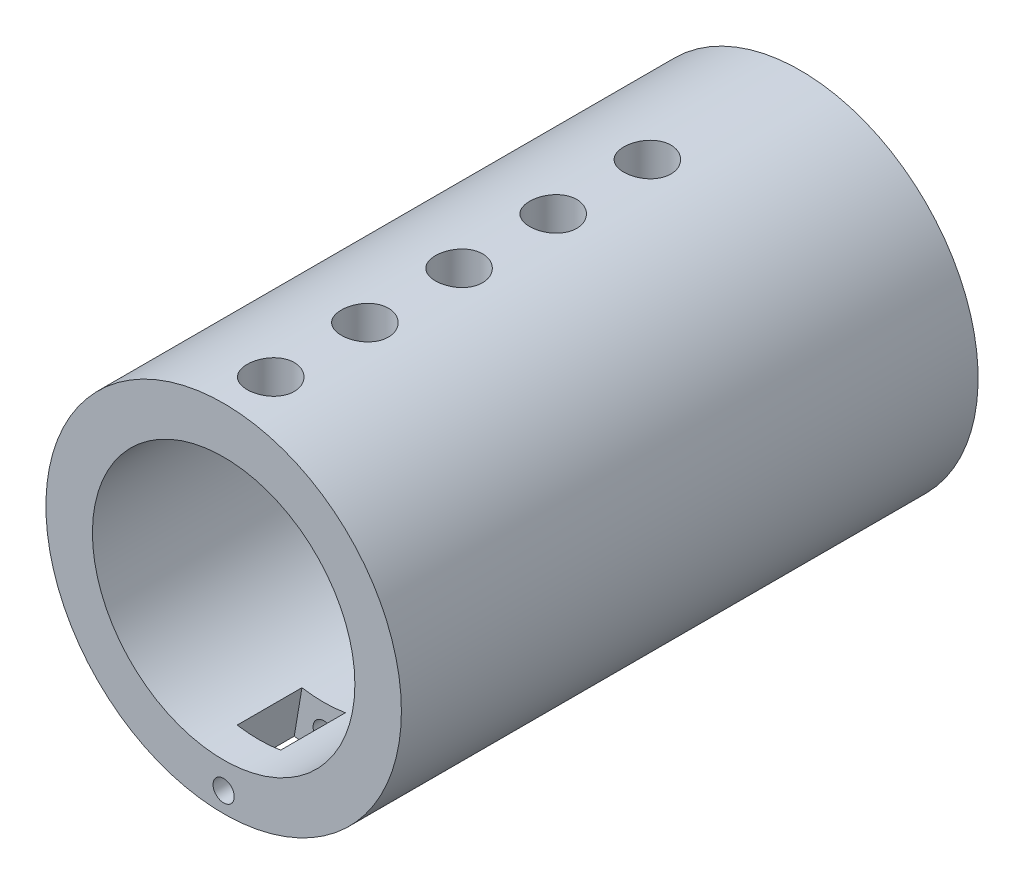
from build123d import *

# Parameters (mm, degrees)
SKETCH1_R           = 15.102178337
SKETCH1_R_2         = 11.15
BOSS_EXTRUDE1_DEPTH = 49
SKETCH2_W           = 2
SKETCH2_H           = 2
CUT_EXTRUDE1_DEPTH  = 2
CUT_EXTRUDE2_DEPTH  = 1.1
SKETCH7_R           = 2
PIN_HOLE_DEPTH      = 54.452329987
CUT_EXTRUDE4_START  = -8.5
CUT_EXTRUDE4_DEPTH  = 5.5
CUT_EXTRUDE5_START  = -15
CUT_EXTRUDE5_DEPTH  = 15


with BuildPart() as part:
    # Sketch1 → Boss-Extrude1 (new body)
    with BuildSketch(Plane.XY):
        Circle(SKETCH1_R)
        Circle(SKETCH1_R_2, mode=Mode.SUBTRACT)
    extrude(amount=BOSS_EXTRUDE1_DEPTH)

    # Sketch2 → Cut-Extrude1 (cut)
    with BuildSketch(Plane(origin=(0, 0, 0), x_dir=(-1, 0, 0), z_dir=(0, 0, -1))):
        with BuildLine():
            Line((2, -14.969161317), (0, -14.969161317))
            Line((0, -14.969161317), (0, -15.102178337))
            ThreePointArc((0, -15.102178337), (1.002209251, -15.068887389), (2, -14.969161317))
        make_face()
        with BuildLine():
            Line((0, -15.102178337), (0, -14.969161317))
            Line((0, -14.969161317), (-2, -14.969161317))
            ThreePointArc((-2, -14.969161317), (-1.002209251, -15.068887389), (0, -15.102178337))
        make_face()
        with Locations((1, -13.969161317)):
            Rectangle(SKETCH2_W, SKETCH2_H)
        with Locations((-1, -13.969161317)):
            Rectangle(SKETCH2_W, SKETCH2_H)
    extrude(amount=-CUT_EXTRUDE1_DEPTH, mode=Mode.SUBTRACT)

    # Sketch6 → Cut-Extrude2 (cut)
    with BuildSketch(Plane(origin=(0, 0, 0), x_dir=(-1, 0, 0), z_dir=(0, 0, -1))):
        with BuildLine():
            Line((-1.931965643, -12.197951006), (-1.744244285, -11.012724998))
            ThreePointArc((-1.744244285, -11.012724998), (-7.241345739, 8.478526516), (11.15, 0))
            ThreePointArc((11.15, 0), (8.478526516, -7.241345739), (1.744244285, -11.012724998))
            Line((1.744244285, -11.012724998), (1.931965643, -12.197951006))
            ThreePointArc((1.931965643, -12.197951006), (9.391013675, -8.020683397), (12.35, 0))
            ThreePointArc((12.35, 0), (-8.020683397, 9.391013675), (-1.931965643, -12.197951006))
        make_face()
    extrude(amount=-CUT_EXTRUDE2_DEPTH, mode=Mode.SUBTRACT)

    # Sketch7 → Pin hole (cut, through all)
    with BuildSketch(Plane(origin=(0, 0, 0), x_dir=(1, 0, 0), z_dir=(0, 1, 0))):
        with Locations(Location((0, -13, 0), (0, 0, 90))):
            Circle(SKETCH7_R)
        with Locations(Location((0, -21, 0), (0, 0, 90))):
            Circle(SKETCH7_R)
        with Locations(Location((0, -29, 0), (0, 0, 90))):
            Circle(SKETCH7_R)
        with Locations(Location((0, -37, 0), (0, 0, 90))):
            Circle(SKETCH7_R)
        with Locations(Location((0, -45, 0), (0, 0, 90))):
            Circle(SKETCH7_R)
    extrude(amount=PIN_HOLE_DEPTH, mode=Mode.SUBTRACT)

    # Sketch8 → Cut-Extrude4 (cut)
    with BuildSketch(Plane.XY.offset(49).offset(CUT_EXTRUDE4_START)):
        with BuildLine():
            Line((2.5, -14.893817192), (1.845760219, -10.996166114))
            ThreePointArc((1.845760219, -10.996166114), (0.926079863, -11.111474974), (0, -11.15))
            Line((0, -11.15), (0, -12.502178337))
            ThreePointArc((0, -12.502178337), (0.636396103, -12.765782234), (0.9, -13.402178337))
            ThreePointArc((0.9, -13.402178337), (0.636396103, -14.038574441), (0, -14.302178337))
            Line((0, -14.302178337), (0, -15.102178337))
            ThreePointArc((0, -15.102178337), (1.254333924, -15.049997905), (2.5, -14.893817192))
        make_face()
        with BuildLine():
            ThreePointArc((0, -11.15), (-0.926079863, -11.111474974), (-1.845760219, -10.996166114))
            Line((-1.845760219, -10.996166114), (-2.5, -14.893817192))
            ThreePointArc((-2.5, -14.893817192), (-1.254333924, -15.049997905), (0, -15.102178337))
            Line((0, -15.102178337), (0, -14.302178337))
            ThreePointArc((0, -14.302178337), (-0.9, -13.402178337), (0, -12.502178337))
            Line((0, -12.502178337), (0, -11.15))
        make_face()
    extrude(amount=CUT_EXTRUDE4_DEPTH, mode=Mode.SUBTRACT)

    # Sketch8<3> → Cut-Extrude5 (cut)
    with BuildSketch(Plane.XY.offset(49).offset(CUT_EXTRUDE5_START)):
        with BuildLine():
            ThreePointArc((0.9, -13.402178337), (0.636396103, -12.765782234), (0, -12.502178337))
            Line((0, -12.502178337), (0, -14.302178337))
            ThreePointArc((0, -14.302178337), (0.636396103, -14.038574441), (0.9, -13.402178337))
        make_face()
        with BuildLine():
            Line((0, -14.302178337), (0, -12.502178337))
            ThreePointArc((0, -12.502178337), (-0.9, -13.402178337), (0, -14.302178337))
        make_face()
    extrude(amount=CUT_EXTRUDE5_DEPTH, mode=Mode.SUBTRACT)


solid = part.part
